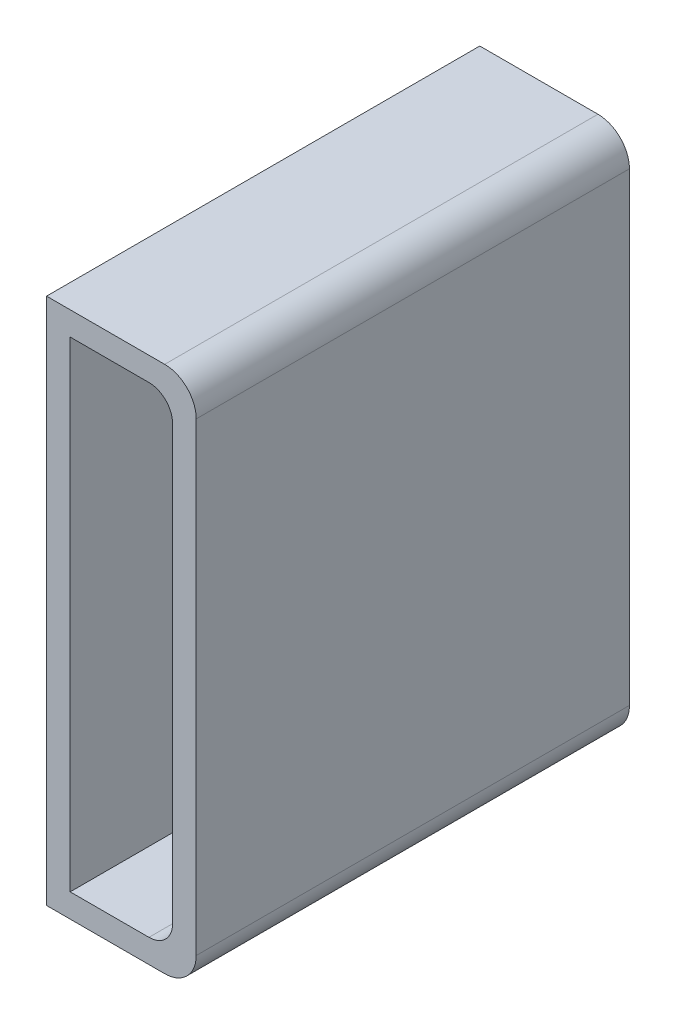
from build123d import *

# Parameters (mm, degrees)
SKETCH1_W           = 67
SKETCH1_H           = 55
BOSS_EXTRUDE1_DEPTH = 19
SKETCH3_W           = 13
SKETCH3_H           = 61
CUT_EXTRUDE1_DEPTH  = 51
FILLET1_R           = 4
FILLET2_R           = 3


with BuildPart() as part:
    # Sketch1 → Boss-Extrude1 (new body)
    with BuildSketch(Plane.YZ):
        Rectangle(SKETCH1_W, SKETCH1_H)
    extrude(amount=BOSS_EXTRUDE1_DEPTH)

    # Sketch3 → Cut-Extrude1 (cut)
    with BuildSketch(Plane.XY.offset(27.5)):
        with Locations((9.5, 0)):
            Rectangle(SKETCH3_W, SKETCH3_H)
    extrude(amount=-CUT_EXTRUDE1_DEPTH, mode=Mode.SUBTRACT)

    # Fillet1
    fillet1_edges = [part.edges().sort_by_distance(p)[0] for p in [
        (19, -33.5, 0),
        (19, 33.5, 0),
    ]]
    fillet(fillet1_edges, radius=FILLET1_R)

    # Fillet2
    fillet2_edges = [part.edges().sort_by_distance(p)[0] for p in [
        (16, 30.5, 2),
        (16, -30.5, 2),
    ]]
    fillet(fillet2_edges, radius=FILLET2_R)


solid = part.part
